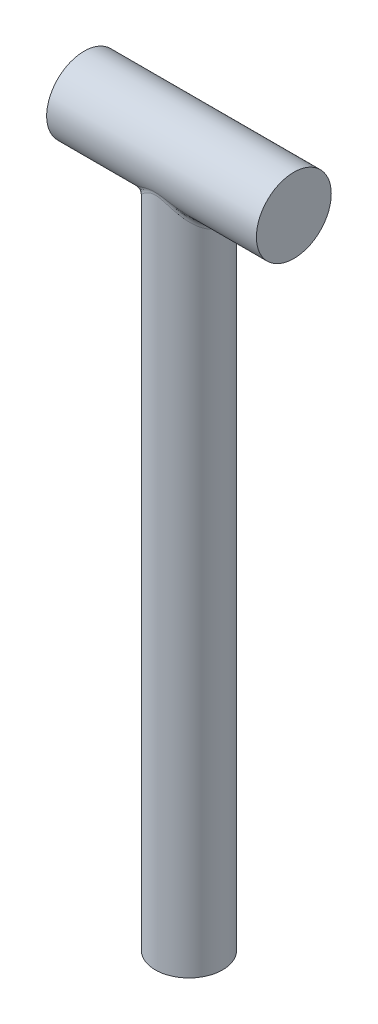
from build123d import *

# Parameters (mm, degrees)
CROQUIS1_W                   = 2.25
CROQUIS1_H                   = 46
SALIENTE_EXTRUIR1_DEPTH      = 7
SALIENTE_EXTRUIR1_DEPTH_BACK = 7
CROQUIS2_R                   = 2.5
REDONDEO3_R                  = 0.5


with BuildPart() as part:
    # Croquis1 → Revolución1 (revolve)
    with BuildSketch(Plane.XY):
        with Locations((1.125, 23)):
            Rectangle(CROQUIS1_W, CROQUIS1_H)
    revolve(axis=Axis((0, 0, 0), (0, 1, 0)))

    # Croquis2 → Saliente-Extruir1 (add, two sides: drawn at the far end of the back side and taken through both)
    with BuildSketch(Plane(origin=(0, 0, 0), x_dir=(0, 0, -1), z_dir=(1, 0, 0)).offset(-SALIENTE_EXTRUIR1_DEPTH_BACK)):
        with Locations((0, 46)):
            Circle(CROQUIS2_R)
    extrude(amount=SALIENTE_EXTRUIR1_DEPTH + SALIENTE_EXTRUIR1_DEPTH_BACK)

    # Redondeo3
    redondeo3_edges = [part.edges().sort_by_distance(p)[0] for p in [
        (1.560544062, 44.096635151, 1.620864661),
    ]]
    fillet(redondeo3_edges, radius=REDONDEO3_R)


solid = part.part
